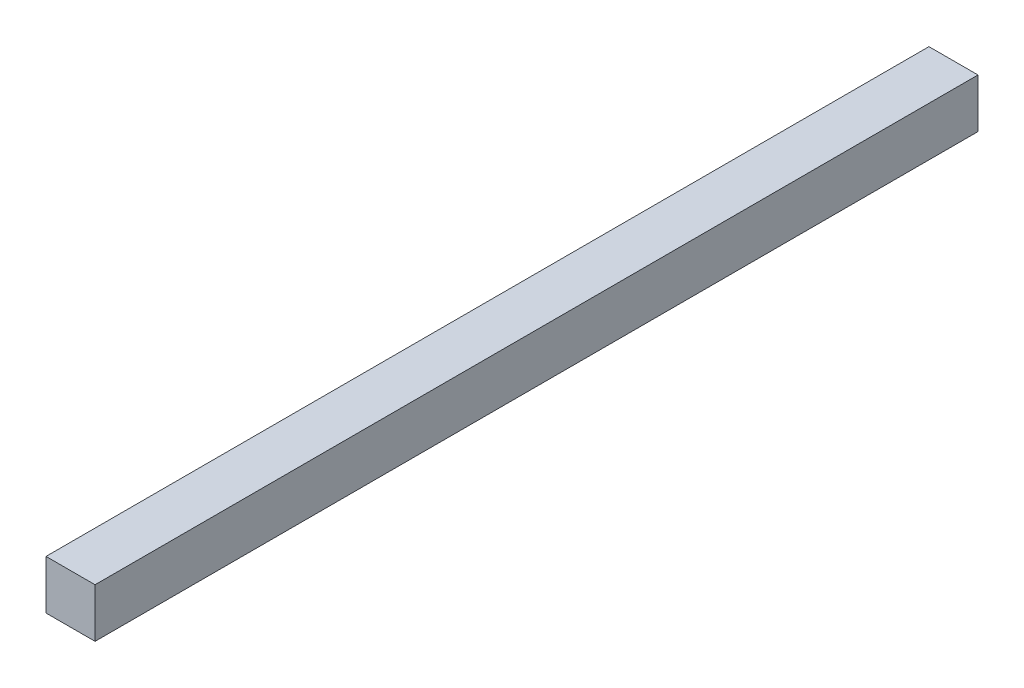
from build123d import *

# Parameters (mm, degrees)
SKETCH1_W           = 25.4
SKETCH1_H           = 25.4
BOSS_EXTRUDE1_DEPTH = 457.2


with BuildPart() as part:
    # Sketch1 → Boss-Extrude1 (new body)
    with BuildSketch(Plane.XY):
        with Locations((-12.7, -12.7)):
            Rectangle(SKETCH1_W, SKETCH1_H)
    extrude(amount=BOSS_EXTRUDE1_DEPTH)


solid = part.part
